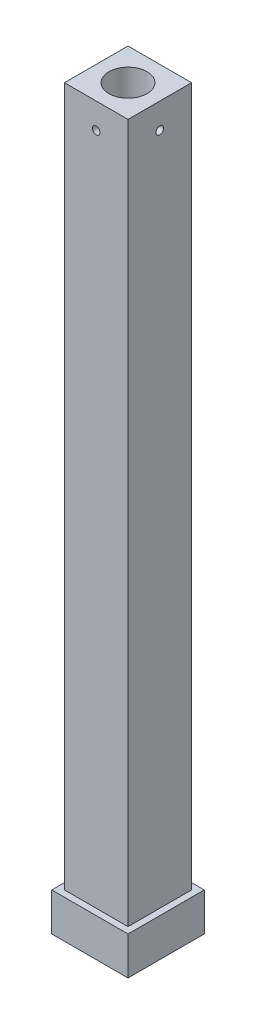
from build123d import *

# Parameters (mm, degrees)
SKETCH_1_W          = 5
SKETCH_1_H          = 5
EXTRUDE_1_DEPTH     = 58
SKETCH_1_5_W        = 6
SKETCH_1_5_H        = 6
EXTRUDE_2_DEPTH     = 3
SKETCH_1_3_R        = 1.5
CUT_EXTRUDE_1_DEPTH = 59.154965394
CUT_EXTRUDE_2_DEPTH = 2
SKETCH_3_R          = 0.3
CUT_EXTRUDE_3_DEPTH = 59.337380812
SKETCH_4_R          = 0.3
CUT_EXTRUDE_4_DEPTH = 59.337380911


with BuildPart() as part:
    # 草图1 → 凸台-拉伸1 (new body)
    with BuildSketch(Plane(origin=(0, 0, 0), x_dir=(1, 0, 0), z_dir=(0, 1, 0))):
        Rectangle(SKETCH_1_W, SKETCH_1_H)
    extrude(amount=EXTRUDE_1_DEPTH)

    # 草图1<5> → 凸台-拉伸2 (add)
    with BuildSketch(Plane(origin=(0, 0, 0), x_dir=(1, 0, 0), z_dir=(0, 1, 0))):
        Rectangle(SKETCH_1_5_W, SKETCH_1_5_H)
    extrude(amount=EXTRUDE_2_DEPTH)

    # 草图1<3> → 切除-拉伸1 (cut, through all)
    with BuildSketch(Plane(origin=(0, 0, 0), x_dir=(1, 0, 0), z_dir=(0, 1, 0))):
        Circle(SKETCH_1_3_R)
    extrude(amount=CUT_EXTRUDE_1_DEPTH, mode=Mode.SUBTRACT)

    # 草图1<4> → 切除-拉伸2 (cut)
    with BuildSketch(Plane(origin=(0, 0, 0), x_dir=(1, 0, 0), z_dir=(0, 1, 0))):
        Polygon((2.886751346, 0), (1.443375673, 2.5), (-1.443375673, 2.5), (-2.886751346, 0), (-1.443375673, -2.5), (1.443375673, -2.5), align=None)
    extrude(amount=CUT_EXTRUDE_2_DEPTH, mode=Mode.SUBTRACT)

    # 草图3 → 切除-拉伸3 (cut, through all)
    with BuildSketch(Plane.XY.offset(2.5)):
        with Locations((0, 56)):
            Circle(SKETCH_3_R)
    extrude(amount=-CUT_EXTRUDE_3_DEPTH, mode=Mode.SUBTRACT)

    # 草图4 → 切除-拉伸4 (cut, through all)
    with BuildSketch(Plane.ZY.offset(2.5)):
        with Locations((0, 56)):
            Circle(SKETCH_4_R)
    extrude(amount=-CUT_EXTRUDE_4_DEPTH, mode=Mode.SUBTRACT)


solid = part.part
